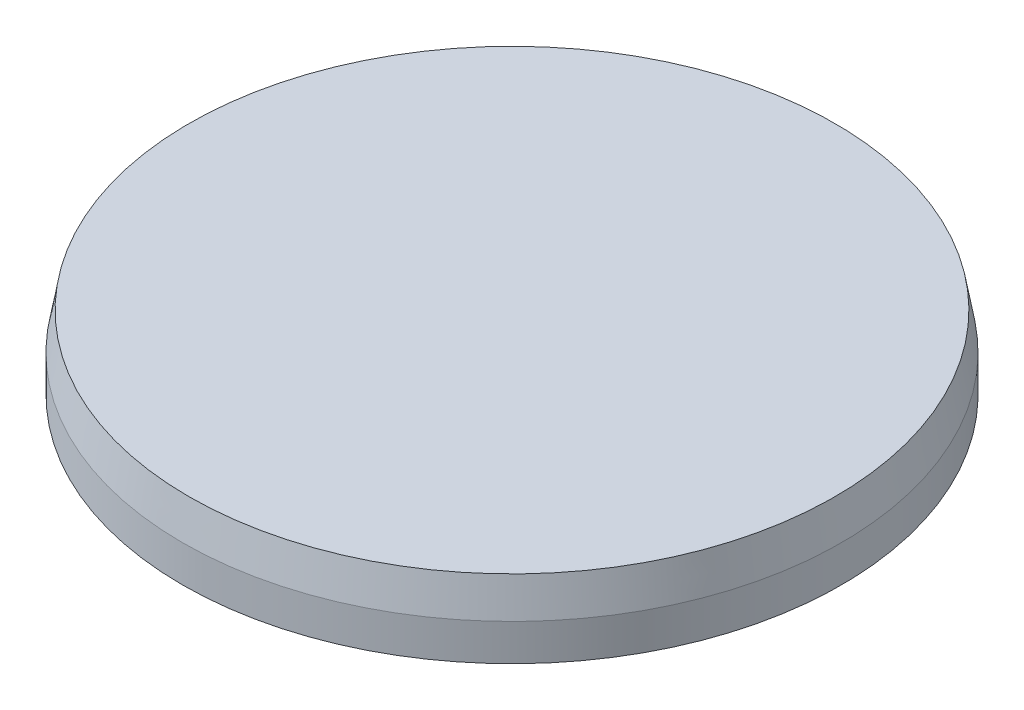
from build123d import *

# Parameters (mm, degrees)
SKETCH_1_R      = 9
EXTRUDE_1_DEPTH = 2
CHAMFER_1_SIZE  = 1
CHAMFER_1_SIZE2 = 0.176326981


with BuildPart() as part:
    # 草图1 → 凸台-拉伸1 (new body)
    with BuildSketch(Plane(origin=(0, 0, 0), x_dir=(1, 0, 0), z_dir=(0, 1, 0))):
        with Locations(Location((0, 0, 0), (0, 0, 270))):
            Circle(SKETCH_1_R)
    extrude(amount=EXTRUDE_1_DEPTH)

    # 倒角1
    chamfer_1_edges = [part.edges().sort_by_distance(p)[0] for p in [
        (0, 2, -9),
    ]]
    chamfer_1_side = [part.faces().sort_by_distance(p)[0] for p in [
        (0, 1, -9),
    ]]
    chamfer(chamfer_1_edges, length=CHAMFER_1_SIZE, length2=CHAMFER_1_SIZE2, reference=chamfer_1_side[0])


solid = part.part
